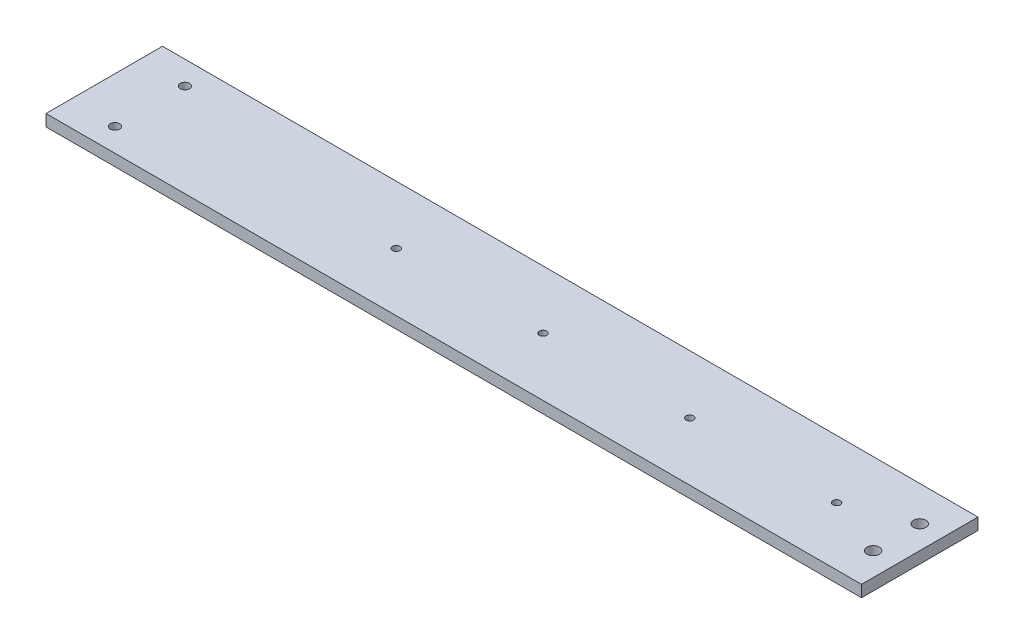
from build123d import *

# Parameters (mm, degrees)
BOSS_EXTRUDE1_DEPTH     = 6.35
SKETCH2_R               = 3.3734375
CUT_EXTRUDE1_DEPTH      = 447.175058133
SKETCH3_R               = 1.27
CUT_EXTRUDE2_DEPTH      = 447.175058133
F_10_32_TAPPED_HOLE1_D  = 4.0386
F_1_4_20_TAPPED_HOLE1_D = 5.1054


with BuildPart() as part:
    # Sketch1 → Boss-Extrude1 (new body)
    with BuildSketch(Plane(origin=(0, 0, 0), x_dir=(1, 0, 0), z_dir=(0, 1, 0))):
        Polygon((50.8, -25.4), (444.5, -25.4), (444.5, 38.1), (50.8, 38.1), (0, 38.1), (0, 12.7), (0, 0), (0, -25.4), align=None)
    extrude(amount=BOSS_EXTRUDE1_DEPTH)

    # Sketch2 → Cut-Extrude1 (cut, through all)
    with BuildSketch(Plane(origin=(0, 6.35, 0), x_dir=(1, 0, 0), z_dir=(0, 1, 0))):
        with Locations(Location((431.8, -6.35, 0), (0, 0, 270))):
            Circle(SKETCH2_R)
        with Locations(Location((431.8, 19.05, 0), (0, 0, 270))):
            Circle(SKETCH2_R)
    extrude(amount=-CUT_EXTRUDE1_DEPTH, mode=Mode.SUBTRACT)

    # Sketch3 → Cut-Extrude2 (cut, through all)
    with BuildSketch(Plane(origin=(0, 6.35, 0), x_dir=(1, 0, 0), z_dir=(0, 1, 0))):
        with Locations(Location((24.892, 25.4, 0), (0, 0, 270))):
            Circle(SKETCH3_R)
        with Locations(Location((24.892, -12.7, 0), (0, 0, 270))):
            Circle(SKETCH3_R)
    extrude(amount=-CUT_EXTRUDE2_DEPTH, mode=Mode.SUBTRACT)

    # #10-32 Tapped Hole1 (through all)
    with Locations(Plane(origin=(0, 6.35, 0), x_dir=(-1, 0, 0), z_dir=(0, 1, 0))):
        with Locations((-159.18, -6.35), (-239.18, -6.35), (-399.18000004, -6.35), (-319.18, -6.35)):
            Hole(F_10_32_TAPPED_HOLE1_D / 2)

    # 1/4-20 Tapped Hole1 (through all)
    with Locations(Plane(origin=(0, 6.35, 0), x_dir=(1, 0, 0), z_dir=(0, 1, 0))):
        with Locations((24.892, -12.7), (24.892, 25.4)):
            Hole(F_1_4_20_TAPPED_HOLE1_D / 2)


solid = part.part
